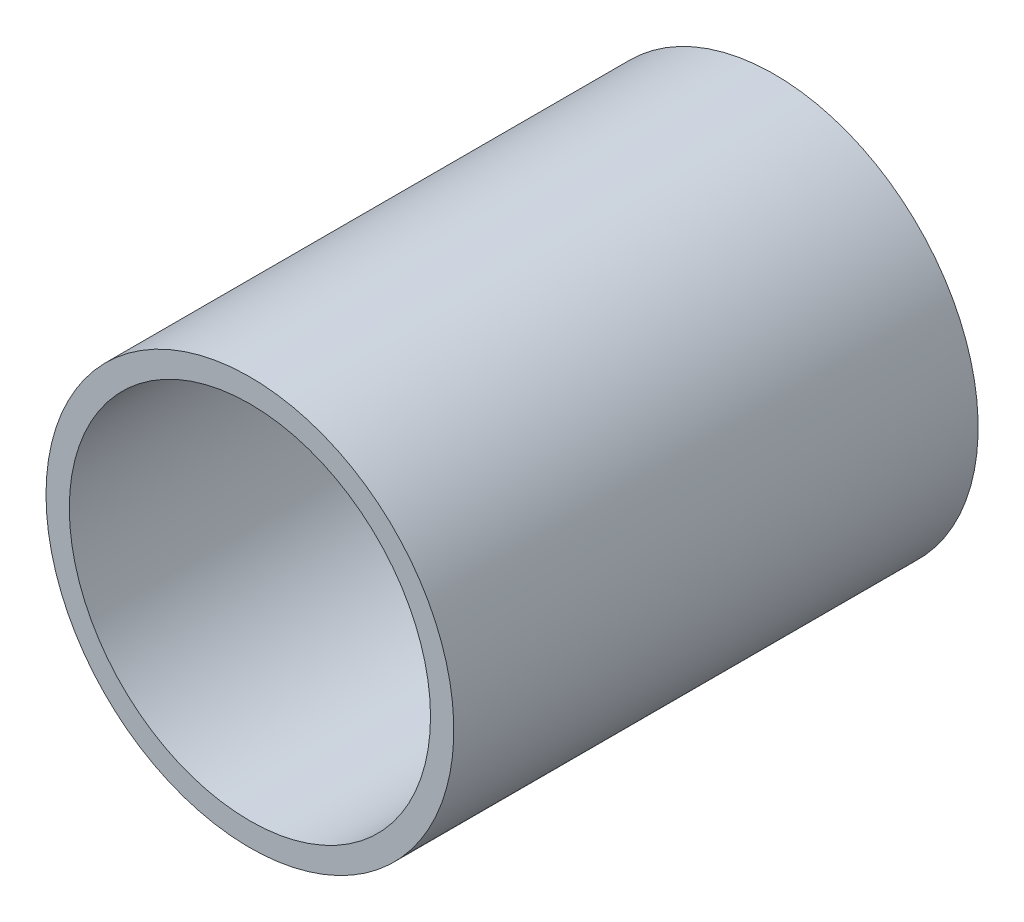
from build123d import *

# Parameters (mm, degrees)
SKETCH1_R           = 35
SKETCH1_R_2         = 31
BOSS_EXTRUDE1_DEPTH = 90


with BuildPart() as part:
    # Sketch1 → Boss-Extrude1 (new body)
    with BuildSketch(Plane.XY):
        with Locations(Location((0, 0, 0), (0, 0, 180))):
            Circle(SKETCH1_R)
        with Locations(Location((0, 0, 0), (0, 0, 180))):
            Circle(SKETCH1_R_2, mode=Mode.SUBTRACT)
    extrude(amount=BOSS_EXTRUDE1_DEPTH)


solid = part.part
